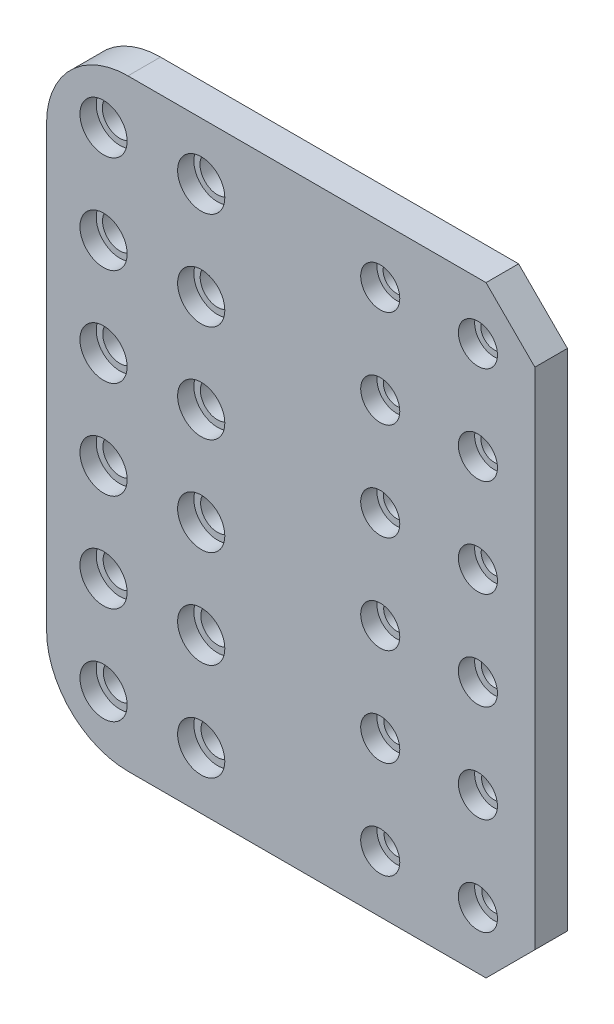
from build123d import *

# Parameters (mm, degrees)
SKETCH1_W           = 60
SKETCH1_H           = 74
BOSS_EXTRUDE1_DEPTH = 12
SKETCH3_R           = 1.65
SKETCH3_R_2         = 1.15
CUT_EXTRUDE1_DEPTH  = 50.122296363
CHAMFER1_SIZE       = 6
FILLET1_R           = 10
SKETCH4_R           = 2.9
SKETCH4_R_2         = 2.4
CUT_EXTRUDE2_DEPTH  = 2
SKETCH6_R           = 2.15
SKETCH6_R_2         = 2.125
SKETCH6_R_3         = 2.1
SKETCH6_R_4         = 2.075
SKETCH6_R_5         = 2.05
SKETCH6_R_6         = 2.025
SKETCH6_R_7         = 1.525
SKETCH6_R_8         = 1.55
SKETCH6_R_9         = 1.575
SKETCH6_R_10        = 1.6
SKETCH6_R_11        = 1.625
SKETCH6_R_12        = 1.65
CUT_EXTRUDE3_DEPTH  = 3.1
SKETCH8_W           = 8
SKETCH8_H           = 74
CUT_EXTRUDE4_DEPTH  = 72.505244563


with BuildPart() as part:
    # Sketch1 → Boss-Extrude1 (new body)
    with BuildSketch(Plane.XY):
        Rectangle(SKETCH1_W, SKETCH1_H)
    extrude(amount=BOSS_EXTRUDE1_DEPTH)

    # Sketch3 → Cut-Extrude1 (cut, through all)
    with BuildSketch(Plane.XY.offset(12)):
        with Locations((-23, -30)):
            Circle(SKETCH3_R)
        with Locations((23, -30)):
            Circle(SKETCH3_R_2)
        with Locations((-11, -30)):
            Circle(SKETCH3_R)
        with Locations((-11, -18)):
            Circle(SKETCH3_R)
        with Locations((-11, -6)):
            Circle(SKETCH3_R)
        with Locations((-11, 6)):
            Circle(SKETCH3_R)
        with Locations((-23, -18)):
            Circle(SKETCH3_R)
        with Locations((-23, -6)):
            Circle(SKETCH3_R)
        with Locations((-23, 6)):
            Circle(SKETCH3_R)
        with Locations((11, -30)):
            Circle(SKETCH3_R_2)
        with Locations((11, -18)):
            Circle(SKETCH3_R_2)
        with Locations((11, -6)):
            Circle(SKETCH3_R_2)
        with Locations((11, 6)):
            Circle(SKETCH3_R_2)
        with Locations((23, -18)):
            Circle(SKETCH3_R_2)
        with Locations((23, -6)):
            Circle(SKETCH3_R_2)
        with Locations((23, 6)):
            Circle(SKETCH3_R_2)
        with Locations((-23, 18)):
            Circle(SKETCH3_R)
        with Locations((-11, 18)):
            Circle(SKETCH3_R)
        with Locations((-23, 30)):
            Circle(SKETCH3_R)
        with Locations((-11, 30)):
            Circle(SKETCH3_R)
        with Locations((23, 18)):
            Circle(SKETCH3_R_2)
        with Locations((11, 18)):
            Circle(SKETCH3_R_2)
        with Locations((23, 30)):
            Circle(SKETCH3_R_2)
        with Locations((11, 30)):
            Circle(SKETCH3_R_2)
    extrude(amount=-CUT_EXTRUDE1_DEPTH, mode=Mode.SUBTRACT)

    # Chamfer1
    chamfer1_edges = [part.edges().sort_by_distance(p)[0] for p in [
        (30, 37, 6),
        (30, -37, 6),
    ]]
    chamfer(chamfer1_edges, length=CHAMFER1_SIZE)

    # Fillet1
    fillet1_edges = [part.edges().sort_by_distance(p)[0] for p in [
        (-30, 37, 6),
        (-30, -37, 6),
    ]]
    fillet(fillet1_edges, radius=FILLET1_R)

    # Sketch4 → Cut-Extrude2 (cut)
    with BuildSketch(Plane.XY.offset(12)):
        with Locations((-23, -30)):
            Circle(SKETCH4_R)
        with Locations((-11, -30)):
            Circle(SKETCH4_R)
        with Locations((-11, -18)):
            Circle(SKETCH4_R)
        with Locations((-11, -6)):
            Circle(SKETCH4_R)
        with Locations((-11, 6)):
            Circle(SKETCH4_R)
        with Locations((-23, -18)):
            Circle(SKETCH4_R)
        with Locations((-23, -6)):
            Circle(SKETCH4_R)
        with Locations((-23, 6)):
            Circle(SKETCH4_R)
        with Locations((11, -30)):
            Circle(SKETCH4_R_2)
        with Locations((23, -30)):
            Circle(SKETCH4_R_2)
        with Locations((23, -18)):
            Circle(SKETCH4_R_2)
        with Locations((23, -6)):
            Circle(SKETCH4_R_2)
        with Locations((23, 6)):
            Circle(SKETCH4_R_2)
        with Locations((11, -18)):
            Circle(SKETCH4_R_2)
        with Locations((11, -6)):
            Circle(SKETCH4_R_2)
        with Locations((11, 6)):
            Circle(SKETCH4_R_2)
        with Locations((-23, 18)):
            Circle(SKETCH4_R)
        with Locations((-11, 18)):
            Circle(SKETCH4_R)
        with Locations((-23, 30)):
            Circle(SKETCH4_R)
        with Locations((-11, 30)):
            Circle(SKETCH4_R)
        with Locations((11, 18)):
            Circle(SKETCH4_R_2)
        with Locations((23, 18)):
            Circle(SKETCH4_R_2)
        with Locations((11, 30)):
            Circle(SKETCH4_R_2)
        with Locations((23, 30)):
            Circle(SKETCH4_R_2)
    extrude(amount=-CUT_EXTRUDE2_DEPTH, mode=Mode.SUBTRACT)

    # Sketch6 → Cut-Extrude3 (cut)
    with BuildSketch(Plane.XY.offset(10)):
        with Locations((-23, 30)):
            Circle(SKETCH6_R)
        with Locations((-23, 18)):
            Circle(SKETCH6_R_2)
        with Locations((-23, 6)):
            Circle(SKETCH6_R_3)
        with Locations((-23, -6)):
            Circle(SKETCH6_R_4)
        with Locations((-23, -18)):
            Circle(SKETCH6_R_5)
        with Locations((-23, -30)):
            Circle(SKETCH6_R_6)
        with Locations((-11, 30)):
            Circle(SKETCH6_R)
        with Locations((11, -30)):
            Circle(SKETCH6_R_7)
        with Locations((11, -18)):
            Circle(SKETCH6_R_8)
        with Locations((11, -6)):
            Circle(SKETCH6_R_9)
        with Locations((11, 6)):
            Circle(SKETCH6_R_10)
        with Locations((11, 18)):
            Circle(SKETCH6_R_11)
        with Locations((11, 30)):
            Circle(SKETCH6_R_12)
        with Locations((-11, 18)):
            Circle(SKETCH6_R_2)
        with Locations((-11, 6)):
            Circle(SKETCH6_R_3)
        with Locations((-11, -6)):
            Circle(SKETCH6_R_4)
        with Locations((-11, -18)):
            Circle(SKETCH6_R_5)
        with Locations((-11, -30)):
            Circle(SKETCH6_R_6)
        with Locations((23, -30)):
            Circle(SKETCH6_R_7)
        with Locations((23, -18)):
            Circle(SKETCH6_R_8)
        with Locations((23, -6)):
            Circle(SKETCH6_R_9)
        with Locations((23, 6)):
            Circle(SKETCH6_R_10)
        with Locations((23, 18)):
            Circle(SKETCH6_R_11)
        with Locations((23, 30)):
            Circle(SKETCH6_R_12)
    extrude(amount=-CUT_EXTRUDE3_DEPTH, mode=Mode.SUBTRACT)

    # Sketch8 → Cut-Extrude4 (cut, through all)
    with BuildSketch(Plane.ZY.offset(30)):
        with Locations((4, 0)):
            Rectangle(SKETCH8_W, SKETCH8_H)
    extrude(amount=-CUT_EXTRUDE4_DEPTH, mode=Mode.SUBTRACT)


solid = part.part
